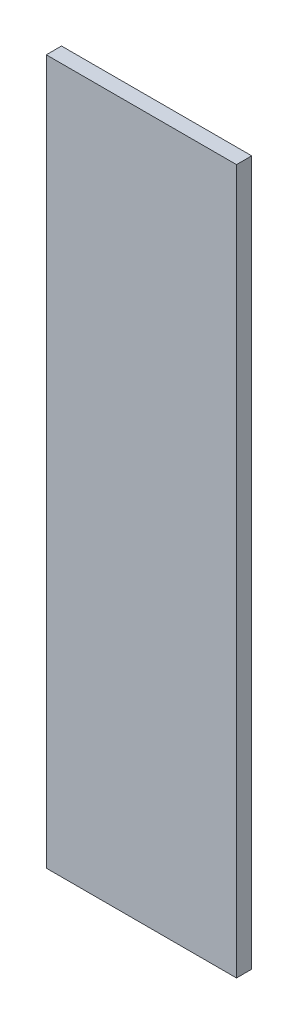
from build123d import *

# Parameters (mm, degrees)
SKETCH1_W           = 25
SKETCH1_H           = 92.58
BOSS_EXTRUDE1_DEPTH = 2


with BuildPart() as part:
    # Sketch1 → Boss-Extrude1 (new body)
    with BuildSketch(Plane.XY):
        Rectangle(SKETCH1_W, SKETCH1_H)
    extrude(amount=BOSS_EXTRUDE1_DEPTH)


solid = part.part
